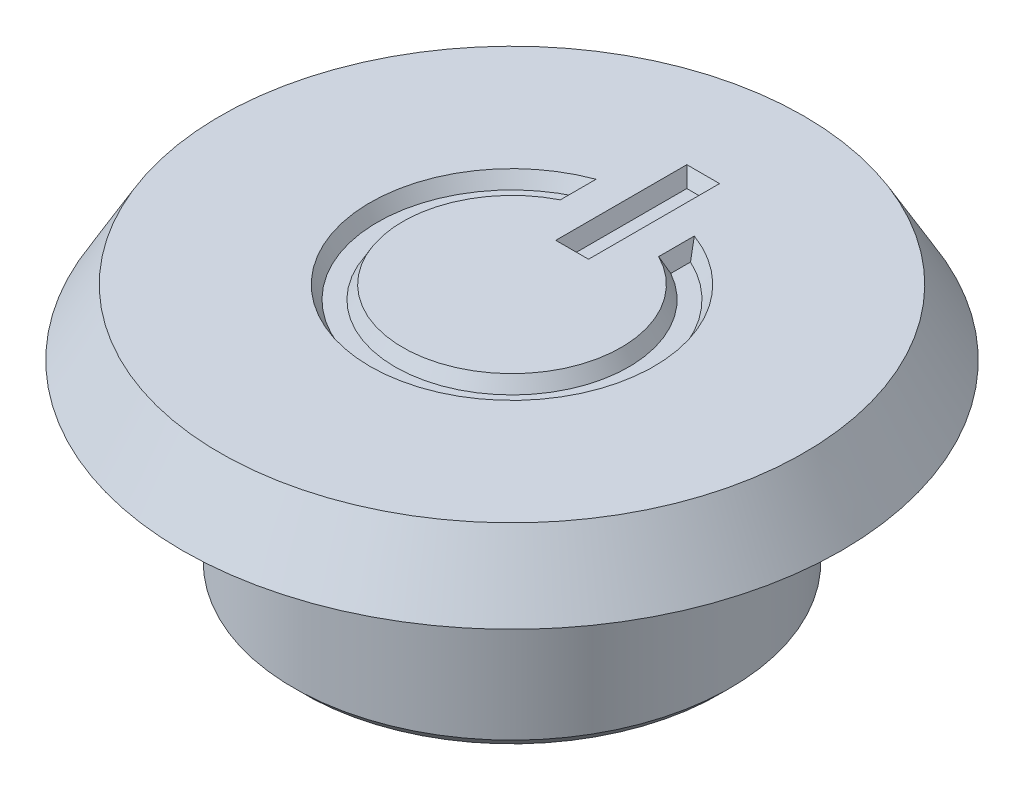
from build123d import *

# Parameters (mm, degrees)
CUT_EXTRUDE_1_DEPTH           = 1.2
CUT_EXTRUDE_1_DRAFT           = -30
SKETCH_3_W                    = 3
SKETCH_3_H                    = 12
CUT_EXTRUDE_1_PROFILE_2_DEPTH = 1.2
CUT_EXTRUDE_1_PROFILE_2_DRAFT = -30


with BuildPart() as part:
    # Эскиз1 → Повернуть1 (revolve)
    with BuildSketch(Plane.XY, mode=Mode.PRIVATE) as revolve_1_sk:
        with BuildLine():
            Line((0, 64.100995099), (-26.732050808, 64.100995099))
            Line((-26.732050808, 64.100995099), (-30.196152423, 58.100995099))
            Line((-30.196152423, 58.100995099), (-26.732050808, 58.100995099))
            Line((-26.732050808, 58.100995099), (-25, 61.100995099))
            Line((-25, 61.100995099), (-20, 61.100995099))
            Line((-20, 61.100995099), (-20, 42.100995099))
            Line((-20, 42.100995099), (-19, 41.100995099))
            Line((-19, 41.100995099), (-18, 41.100995099))
            Line((-18, 41.100995099), (-18, 58.100995099))
            ThreePointArc((-18, 58.100995099), (-17.121320344, 60.222315442), (-15, 61.100995099))
            Line((-15, 61.100995099), (0, 61.100995099))
            Line((0, 61.100995099), (0, 64.100995099))
        make_face()
    revolve(revolve_1_sk.sketch.rotate(Axis((0, 61.100995099, 0), (0, 1, 0)), 270), axis=Axis((0, 61.100995099, 0), (0, 1, 0)))


with BuildPart() as cut_extrude_1_tool:
    # Эскиз3 → Вырез-Вытянуть1 (with draft: the straight prism first)
    with BuildSketch(Plane(origin=(0, 64.100995099, 0), x_dir=(1, 0, 0), z_dir=(0, 1, 0))):
        with BuildLine():
            Line((-4.5, 12.196310918), (-4.5, 8.93028555))
            ThreePointArc((-4.5, 8.93028555), (0, -10), (4.5, 8.93028555))
            Line((4.5, 8.93028555), (4.5, 12.196310918))
            ThreePointArc((4.5, 12.196310918), (0, -13), (-4.5, 12.196310918))
        make_face()
    extrude(amount=-CUT_EXTRUDE_1_DEPTH)
    # Вырез-Вытянуть1: the draft: its side faces are tilted about the plane it starts from
    cut_extrude_1_sides = [cut_extrude_1_tool.faces().sort_by_distance(p)[0] for p in [
        (-4.5, 63.500995099, -10.563298234),
        (0, 63.500995099, 10),
        (4.5, 63.500995099, -10.563298234),
        (0, 63.500995099, 13),
    ]]
    draft(cut_extrude_1_sides, Plane(origin=(0, 64.100995099, 0), x_dir=(1, 0, 0), z_dir=(0, 1, 0)), CUT_EXTRUDE_1_DRAFT)


with BuildPart() as part_1:
    add(part.part)

    # Вырез-Вытянуть1: cut by cut_extrude_1_tool
    add(cut_extrude_1_tool.part, mode=Mode.SUBTRACT)


with BuildPart() as cut_extrude_1_profile_2_tool:
    # Эскиз3 → Вырез-Вытянуть1 profile 2 (with draft: the straight prism first)
    with BuildSketch(Plane(origin=(0, 64.100995099, 0), x_dir=(1, 0, 0), z_dir=(0, 1, 0))):
        with Locations((0, 11.509630879)):
            Rectangle(SKETCH_3_W, SKETCH_3_H)
    extrude(amount=-CUT_EXTRUDE_1_PROFILE_2_DEPTH)
    # Вырез-Вытянуть1 profile 2: the draft: its side faces are tilted about the plane it starts from
    cut_extrude_1_profile_2_sides = [cut_extrude_1_profile_2_tool.faces().sort_by_distance(p)[0] for p in [
        (-1.5, 63.500995099, -11.509630879),
        (0, 63.500995099, -5.509630879),
        (1.5, 63.500995099, -11.509630879),
        (0, 63.500995099, -17.509630879),
    ]]
    draft(cut_extrude_1_profile_2_sides, Plane(origin=(0, 64.100995099, 0), x_dir=(1, 0, 0), z_dir=(0, 1, 0)), CUT_EXTRUDE_1_PROFILE_2_DRAFT)


with BuildPart() as part_2:
    add(part_1.part)

    # Вырез-Вытянуть1 profile 2: cut by cut_extrude_1_profile_2_tool
    add(cut_extrude_1_profile_2_tool.part, mode=Mode.SUBTRACT)


solid = part_2.part
